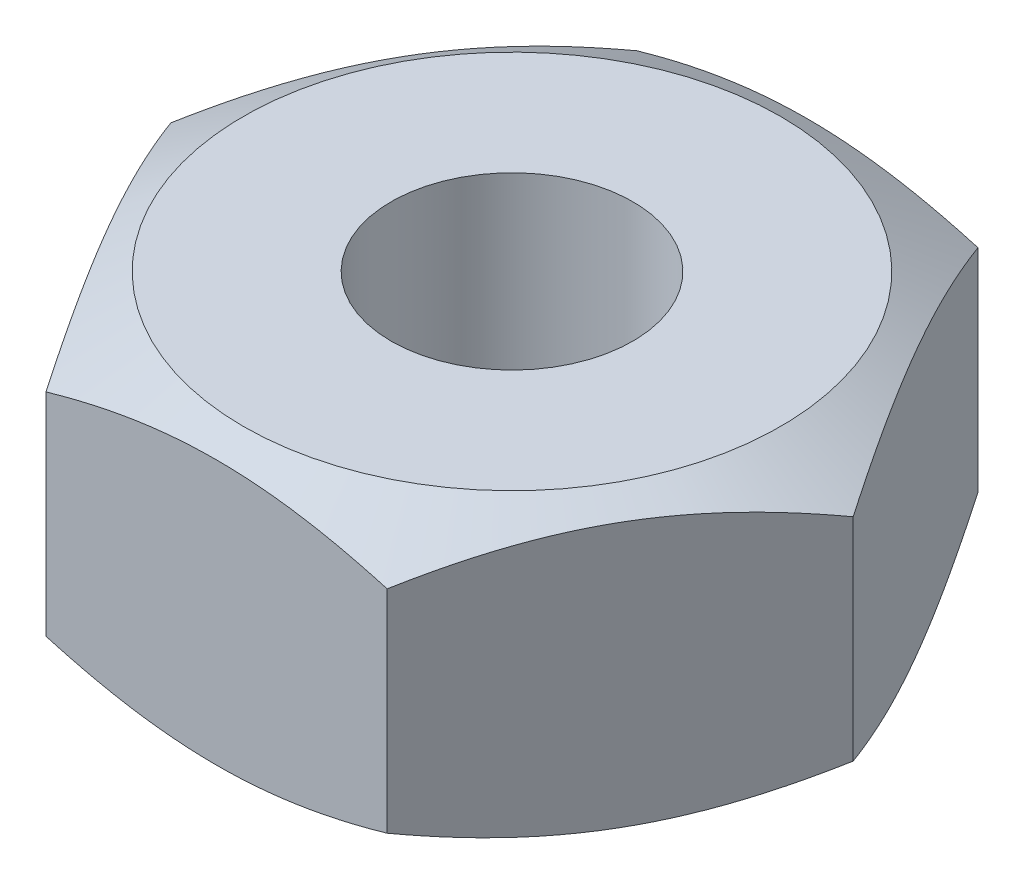
from build123d import *

# Parameters (mm, degrees)
SALIENTE_EXTRUIR6_DEPTH = 5.5
CROQUIS6_R              = 4.5
CORTAR_EXTRUIR1_DEPTH   = 11
CROQUIS10_OUTSIDE_W     = 69.118
CROQUIS10_OUTSIDE_H     = 65.714
CROQUIS10_OUTSIDE_R     = 10
CORTAR_EXTRUIR2_DEPTH   = 10
CORTAR_EXTRUIR2_DRAFT   = -60
CROQUIS11_OUTSIDE_W     = 69.118
CROQUIS11_OUTSIDE_H     = 65.714
CROQUIS11_OUTSIDE_R     = 10
CORTAR_EXTRUIR3_DEPTH   = 10
CORTAR_EXTRUIR3_DRAFT   = -60


with BuildPart() as part:
    # Croquis5 → Saliente-Extruir6 (new, symmetric)
    with BuildSketch(Plane(origin=(0, 0, 0), x_dir=(1, 0, 0), z_dir=(0, 1, 0))):
        Polygon((12.701705922, 0), (6.350852961, 11), (-6.350852961, 11), (-12.701705922, 0), (-6.350852961, -11), (6.350852961, -11), align=None)
    extrude(amount=SALIENTE_EXTRUIR6_DEPTH, both=True)

    # Croquis6 → Cortar-Extruir1 (cut)
    with BuildSketch(Plane(origin=(0, 5.5, 0), x_dir=(1, 0, 0), z_dir=(0, 1, 0))):
        with Locations(Location((0, 0, 0), (0, 0, 270))):
            Circle(CROQUIS6_R)
    extrude(amount=-CORTAR_EXTRUIR1_DEPTH, mode=Mode.SUBTRACT)


with BuildPart() as cortar_extruir2_tool:
    # Croquis10 outside → Cortar-Extruir2 (with draft: the straight prism first)
    with BuildSketch(Plane(origin=(0, 5.5, 0), x_dir=(1, 0, 0), z_dir=(0, 1, 0))):
        Rectangle(CROQUIS10_OUTSIDE_W, CROQUIS10_OUTSIDE_H)
        Circle(CROQUIS10_OUTSIDE_R, mode=Mode.SUBTRACT)
    extrude(amount=-CORTAR_EXTRUIR2_DEPTH)
    # Cortar-Extruir2: the draft: its side faces are tilted about the plane it starts from
    cortar_extruir2_sides = [cortar_extruir2_tool.faces().sort_by_distance(p)[0] for p in [
        (0, 0.5, 32.857),
        (34.559, 0.5, 0),
        (0, 0.5, -32.857),
        (-34.559, 0.5, 0),
        (-10, 0.5, 0),
    ]]
    draft(cortar_extruir2_sides, Plane(origin=(0, 5.5, 0), x_dir=(1, 0, 0), z_dir=(0, 1, 0)), CORTAR_EXTRUIR2_DRAFT)


with BuildPart() as part_1:
    add(part.part)

    # Cortar-Extruir2: cut by cortar_extruir2_tool
    add(cortar_extruir2_tool.part, mode=Mode.SUBTRACT)


with BuildPart() as cortar_extruir3_tool:
    # Croquis11 outside → Cortar-Extruir3 (with draft: the straight prism first)
    with BuildSketch(Plane.XZ.offset(5.5)):
        Rectangle(CROQUIS11_OUTSIDE_W, CROQUIS11_OUTSIDE_H)
        Circle(CROQUIS11_OUTSIDE_R, mode=Mode.SUBTRACT)
    extrude(amount=-CORTAR_EXTRUIR3_DEPTH)
    # Cortar-Extruir3: the draft: its side faces are tilted about the plane it starts from
    cortar_extruir3_sides = [cortar_extruir3_tool.faces().sort_by_distance(p)[0] for p in [
        (0, -0.5, -32.857),
        (34.559, -0.5, 0),
        (0, -0.5, 32.857),
        (-34.559, -0.5, 0),
        (-10, -0.5, 0),
    ]]
    draft(cortar_extruir3_sides, Plane.XZ.offset(5.5), CORTAR_EXTRUIR3_DRAFT)


with BuildPart() as part_2:
    add(part_1.part)

    # Cortar-Extruir3: cut by cortar_extruir3_tool
    add(cortar_extruir3_tool.part, mode=Mode.SUBTRACT)


solid = part_2.part
